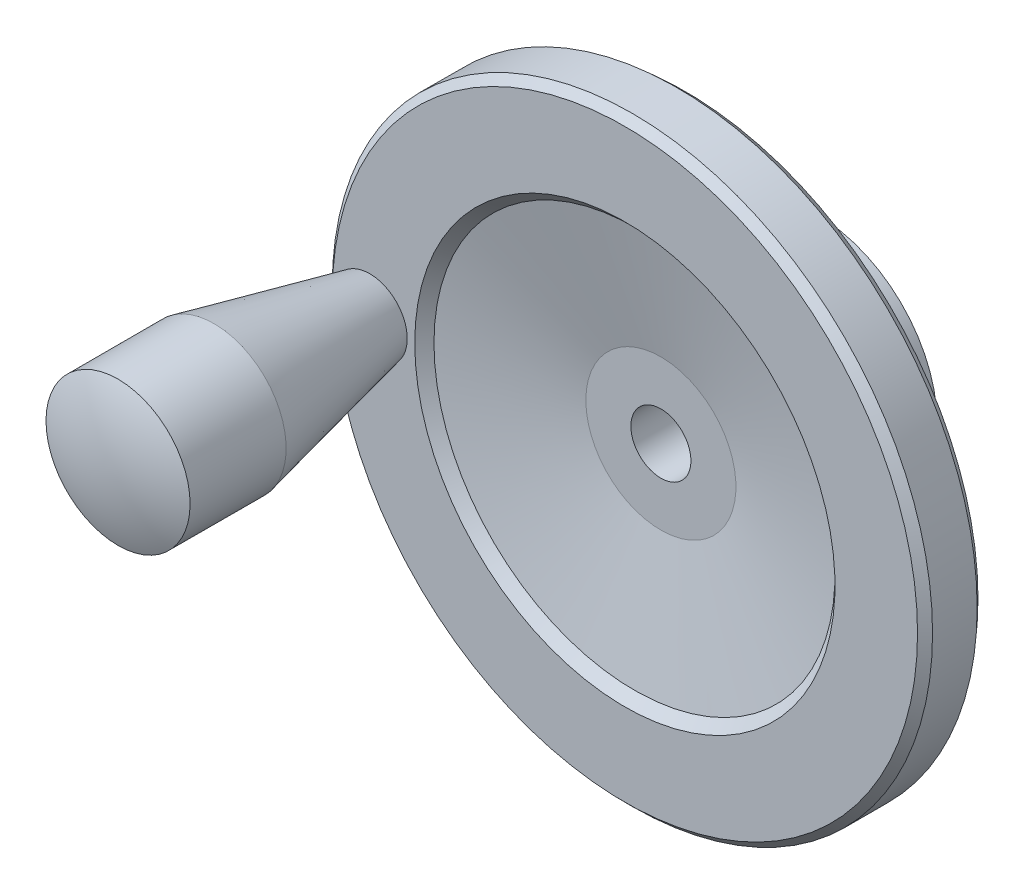
from build123d import *
from OCP.BRepFilletAPI import BRepFilletAPI_MakeChamfer

# Parameters (mm, degrees)
SKETCH1_R                   = 31.75
EXTRUDE1_DEPTH              = 6.35
SKETCH4_R                   = 7.9375
EXTRUDE2_DEPTH              = 6.35
SKETCH5_R                   = 12.7
EXTRUDE3_DEPTH              = 6.35
SKETCH6_R                   = 8.255
EXTRUDE4_DEPTH              = 0.254
SKETCH7_R                   = 3.175
EXTRUDE5_DEPTH              = 50.390428992
FILLET1_R                   = 0.79375
CHAMFER1_SIZE               = 0.79375
CHAMFER1_SIZE2              = 0.839659951
F_10_32_TAPPED_HOLE1_REACH  = 53.959
F_10_32_TAPPED_HOLE1_BORE_R = 2.0193
SKETCH12_R                  = 3.175
EXTRUDE6_DEPTH              = 27.94


with BuildPart() as part:
    # Sketch1 → Extrude1 (new body)
    with BuildSketch(Plane.XY):
        Circle(SKETCH1_R)
    extrude(amount=EXTRUDE1_DEPTH)

    # Sketch2 → Cut-Revolve4 (revolve, cut)
    with BuildSketch(Plane(origin=(0, 0, 0), x_dir=(1, 0, 0), z_dir=(0, 1, 0)), mode=Mode.PRIVATE) as cut_revolve4_sk:
        Polygon((22.225, -6.35), (21.209, -5.334), (7.9375, -2.54), (0, -2.54), (0, -6.35), align=None)
    revolve(cut_revolve4_sk.sketch.rotate(Axis((0, 0, 0), (0, 0, 1)), 180), axis=Axis((0, 0, 0), (0, 0, 1)), mode=Mode.SUBTRACT)

    # Sketch3 → Revolve1 (revolve)
    with BuildSketch(Plane(origin=(0, 0, 0), x_dir=(1, 0, 0), z_dir=(0, 1, 0)), mode=Mode.PRIVATE) as revolve1_sk:
        Polygon((-31.75, 0), (-7.9375, 1.27), (0, 1.27), (0, 0), align=None)
    revolve(revolve1_sk.sketch.rotate(Axis((0, 0, 0), (0, 0, -1)), 180), axis=Axis((0, 0, 0), (0, 0, -1)))

    # Sketch4 → Extrude2 (add)
    with BuildSketch(Plane(origin=(0, 0, -1.27), x_dir=(-1, 0, 0), z_dir=(0, 0, -1))):
        with Locations(Location((0, 0, 0), (0, 0, 180))):
            Circle(SKETCH4_R)
    extrude(amount=EXTRUDE2_DEPTH)

    # Sketch5 → Extrude3 (add)
    with BuildSketch(Plane(origin=(0, 0, -7.62), x_dir=(-1, 0, 0), z_dir=(0, 0, -1))):
        with Locations(Location((0, 0, 0), (0, 0, 180))):
            Circle(SKETCH5_R)
    extrude(amount=EXTRUDE3_DEPTH)

    # Sketch6 → Extrude4 (add)
    with BuildSketch(Plane(origin=(0, 0, -13.97), x_dir=(-1, 0, 0), z_dir=(0, 0, -1))):
        with Locations(Location((0, 0, 0), (0, 0, 180))):
            Circle(SKETCH6_R)
    extrude(amount=EXTRUDE4_DEPTH)

    # Sketch7 → Extrude5 (cut, through all)
    with BuildSketch(Plane(origin=(0, 0, -14.224), x_dir=(-1, 0, 0), z_dir=(0, 0, -1))):
        Circle(SKETCH7_R)
    extrude(amount=-EXTRUDE5_DEPTH, mode=Mode.SUBTRACT)

    # Fillet1
    fillet1_edges = [part.edges().sort_by_distance(p)[0] for p in [
        (-12.7, 0, -7.62),
    ]]
    fillet(fillet1_edges, radius=FILLET1_R)

    # Chamfer1: one chamfer whose edges measure the first distance from different faces: ONE call of the kernel's chamfer builder (chamfer() names one face for all edges)
    chamfer1_edges_1 = [part.edges().sort_by_distance(p)[0] for p in [
        (-31.75, 0, 6.35),
    ]]
    chamfer1_edges_2 = [part.edges().sort_by_distance(p)[0] for p in [
        (-31.75, 0, 0),
    ]]
    chamfer1_side_2 = [part.faces().sort_by_distance(p)[0] for p in [
        (-19.84375, 0, -0.635),
    ]]
    chamfer1 = BRepFilletAPI_MakeChamfer(part.part.solid().wrapped)
    for e in chamfer1_edges_1:
        chamfer1.Add(CHAMFER1_SIZE, e.wrapped)
    for e in chamfer1_edges_2:
        chamfer1.Add(CHAMFER1_SIZE, CHAMFER1_SIZE2, e.wrapped, chamfer1_side_2[0].wrapped)  # the first distance lies on this face
    add(Compound.cast(chamfer1.Shape()), mode=Mode.REPLACE)

    # #10-32 Tapped Hole1 bore → #10-32 Tapped Hole1 (cut, up to next)
    with BuildSketch(Plane(origin=(-7.9375, 0, -4.445), x_dir=(0, -1, 0), z_dir=(-1, 0, 0)), mode=Mode.PRIVATE) as f_10_32_tapped_hole1_sk1:
        with Locations((0, 0.635)):
            Circle(F_10_32_TAPPED_HOLE1_BORE_R)
    f_10_32_tapped_hole1_tool1 = extrude(f_10_32_tapped_hole1_sk1.sketch, amount=-F_10_32_TAPPED_HOLE1_REACH, mode=Mode.PRIVATE) & part.part
    add(f_10_32_tapped_hole1_tool1.solids().sort_by_distance((-7.9375, 0, -3.81))[0], mode=Mode.SUBTRACT)

    # Sketch12 → Extrude6 (add)
    with BuildSketch(Plane.XY.offset(6.35)):
        with Locations((-26.9875, 0)):
            Circle(SKETCH12_R)
    extrude(amount=EXTRUDE6_DEPTH)

    # Sketch13 → Revolve2 (revolve)
    with BuildSketch(Plane(origin=(0, 0, 0), x_dir=(1, 0, 0), z_dir=(0, 1, 0)), mode=Mode.PRIVATE) as revolve2_sk:
        with BuildLine():
            Line((-26.9875, -6.35), (-23.01875, -6.35))
            Line((-23.01875, -6.35), (-19.3675, -22.808497077))
            Line((-19.3675, -22.808497077), (-19.3675, -32.968497077))
            ThreePointArc((-19.3675, -32.968497077), (-23.095695912, -34.154906701), (-26.9875, -34.555997077))
            Line((-26.9875, -34.555997077), (-26.9875, -6.35))
        make_face()
    revolve(revolve2_sk.sketch.rotate(Axis((-26.9875, 0, -6.630939357), (0, 0, 1)), 180), axis=Axis((-26.9875, 0, -6.630939357), (0, 0, 1)))


solid = part.part
